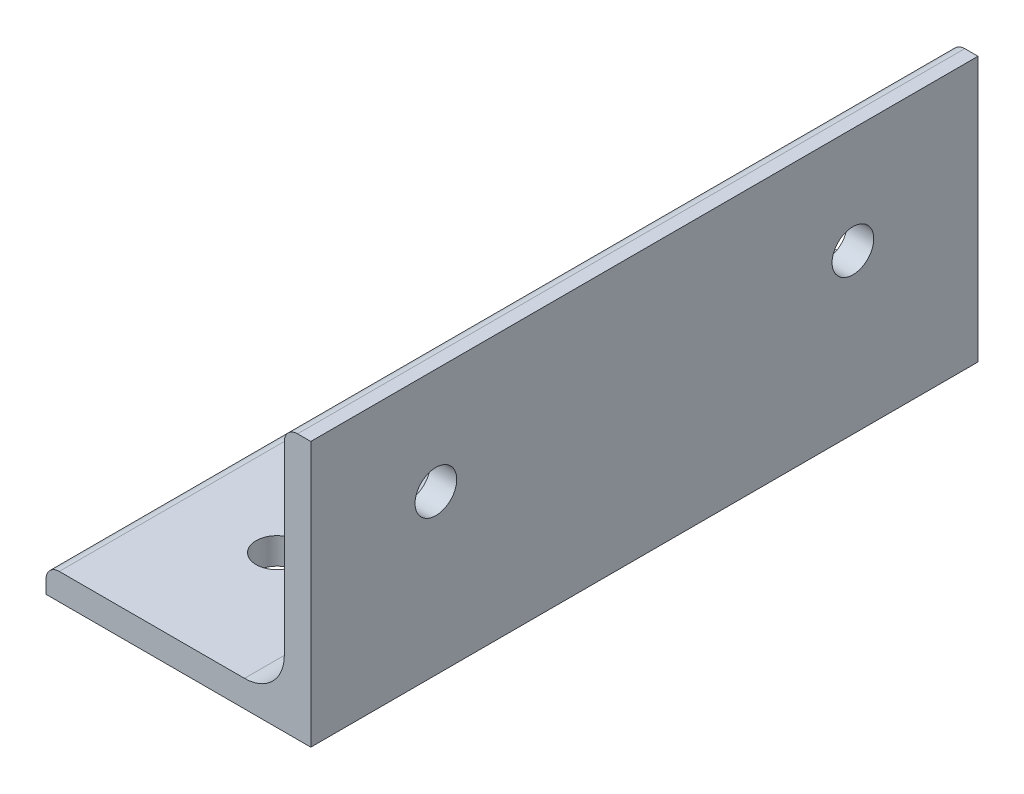
from build123d import *

# Parameters (mm, degrees)
BOSS_EXTRUDE1_DEPTH = 304.8
SKETCH3_W           = 34.414454966
SKETCH3_H           = 33.657940314
CUT_EXTRUDE1_DEPTH  = 529.6
SKETCH5_R           = 2.5
CUT_EXTRUDE2_DEPTH  = 101.6
SKETCH4_R           = 2.5
CUT_EXTRUDE3_DEPTH  = 101.6


with BuildPart() as part:
    # Sketch2 → Boss-Extrude1 (new, symmetric)
    with BuildSketch(Plane.XY):
        with BuildLine():
            Line((-15.875, -15.875), (15.875, -15.875))
            Line((15.875, -15.875), (15.875, 15.875))
            Line((15.875, 15.875), (14.2875, 15.875))
            ThreePointArc((14.2875, 15.875), (13.164967985, 15.410032015), (12.7, 14.2875))
            Line((12.7, 14.2875), (12.7, -7.9248))
            ThreePointArc((12.7, -7.9248), (11.301376302, -11.301376302), (7.9248, -12.7))
            Line((7.9248, -12.7), (-14.2875, -12.7))
            ThreePointArc((-14.2875, -12.7), (-15.410032015, -13.164967985), (-15.875, -14.2875))
            Line((-15.875, -14.2875), (-15.875, -15.875))
        make_face()
    extrude(amount=BOSS_EXTRUDE1_DEPTH, both=True)

    # Sketch3 → Cut-Extrude1 (cut)
    with BuildSketch(Plane(origin=(0, 0, -304.8), x_dir=(-1, 0, 0), z_dir=(0, 0, -1))):
        with Locations((1.332227483, 0.953970157)):
            Rectangle(SKETCH3_W, SKETCH3_H)
    extrude(amount=-CUT_EXTRUDE1_DEPTH, mode=Mode.SUBTRACT)

    # Sketch5 → Cut-Extrude2 (cut)
    with BuildSketch(Plane.ZY.offset(-12.7)):
        with Locations(Location((289.8, 3.18135, 0), (0, 0, 270))):
            Circle(SKETCH5_R)
        with Locations(Location((239.8, 3.18135, 0), (0, 0, 270))):
            Circle(SKETCH5_R)
    extrude(amount=-CUT_EXTRUDE2_DEPTH, mode=Mode.SUBTRACT)

    # Sketch4 → Cut-Extrude3 (cut)
    with BuildSketch(Plane(origin=(0, -12.7, 0), x_dir=(1, 0, 0), z_dir=(0, 1, 0))):
        with Locations(Location((-3.18135, -239.8, 0), (0, 0, 180))):
            Circle(SKETCH4_R)
        with Locations(Location((-3.18135, -289.8, 0), (0, 0, 180))):
            Circle(SKETCH4_R)
    extrude(amount=-CUT_EXTRUDE3_DEPTH, mode=Mode.SUBTRACT)


solid = part.part
